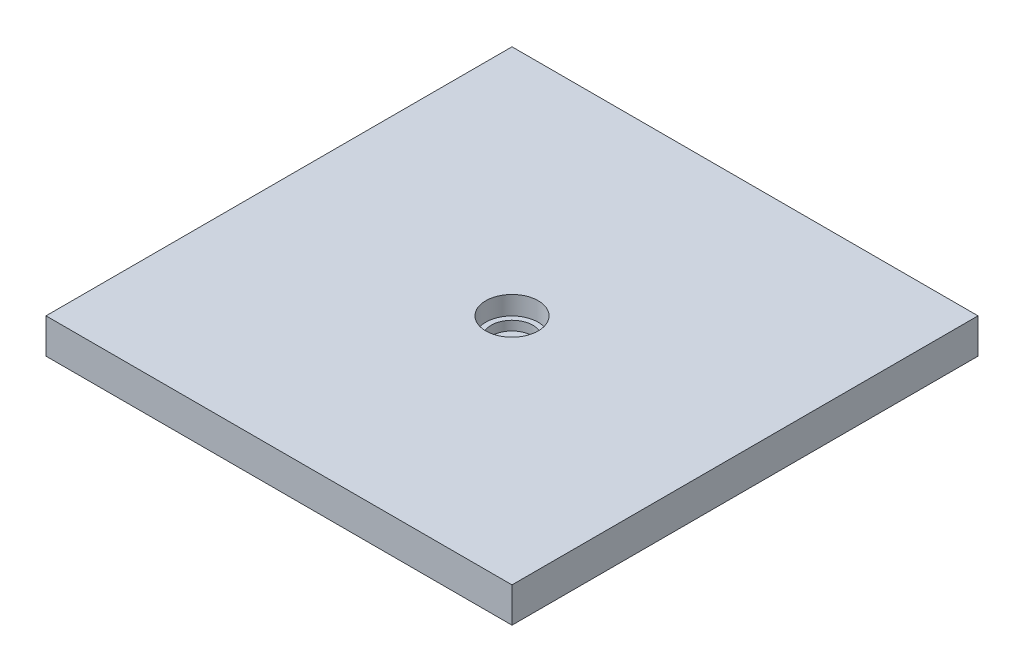
from build123d import *

# Parameters (mm, degrees)
SKETCH2_W           = 200
SKETCH2_H           = 200
BOSS_EXTRUDE1_DEPTH = 15
SKETCH3_R           = 11.25
CUT_EXTRUDE1_DEPTH  = 8
SKETCH4_R           = 9
CUT_EXTRUDE2_DEPTH  = 4


with BuildPart() as part:
    # Sketch2 → Boss-Extrude1 (new body)
    with BuildSketch(Plane(origin=(0, 0, 0), x_dir=(1, 0, 0), z_dir=(0, 1, 0))):
        Rectangle(SKETCH2_W, SKETCH2_H)
    extrude(amount=BOSS_EXTRUDE1_DEPTH)

    # Sketch3 → Cut-Extrude1 (cut)
    with BuildSketch(Plane(origin=(0, 15, 0), x_dir=(1, 0, 0), z_dir=(0, 1, 0))):
        with Locations(Location((0, 0, 0), (0, 0, 270))):
            Circle(SKETCH3_R)
    extrude(amount=-CUT_EXTRUDE1_DEPTH, mode=Mode.SUBTRACT)

    # Sketch4 → Cut-Extrude2 (cut)
    with BuildSketch(Plane(origin=(0, 7, 0), x_dir=(1, 0, 0), z_dir=(0, 1, 0))):
        with Locations(Location((0, 0, 0), (0, 0, 270))):
            Circle(SKETCH4_R)
    extrude(amount=-CUT_EXTRUDE2_DEPTH, mode=Mode.SUBTRACT)


solid = part.part
